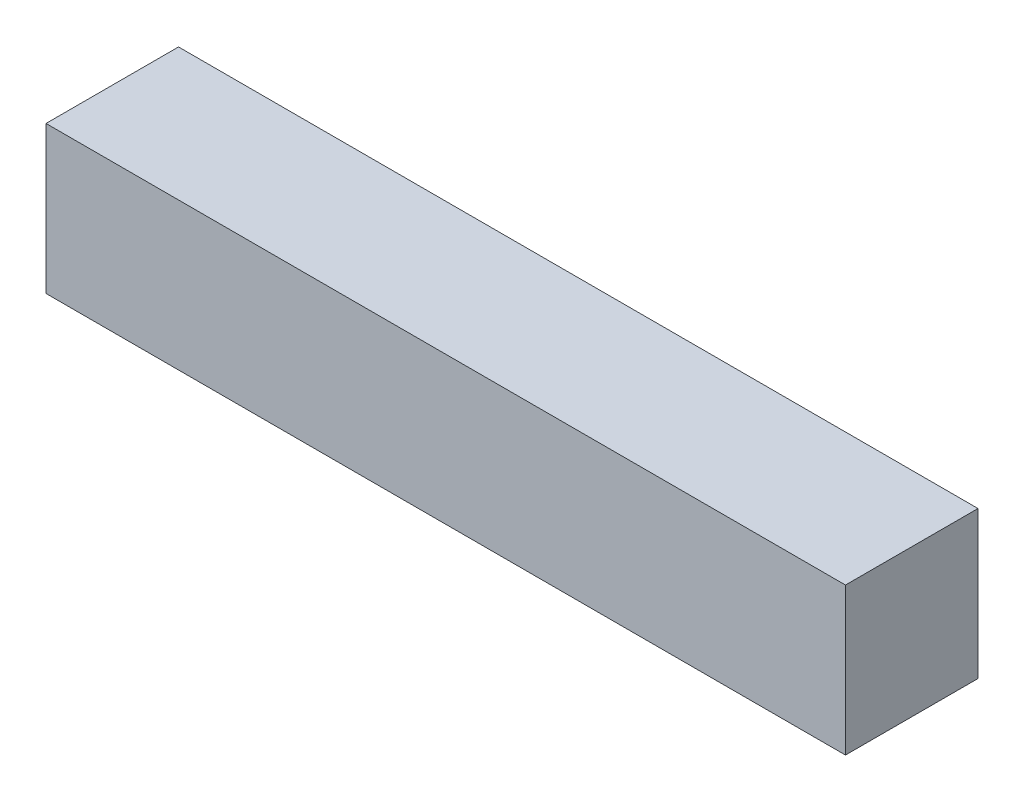
from build123d import *

# Parameters (mm, degrees)
SKIZZE1_W                       = 482.6
SKIZZE1_H                       = 88.9
AUFSATZ_LINEAR_AUSTRAGEN1_DEPTH = 80


with BuildPart() as part:
    # Skizze1 → Aufsatz-Linear austragen1 (new body)
    with BuildSketch(Plane.XY):
        Rectangle(SKIZZE1_W, SKIZZE1_H)
    extrude(amount=-AUFSATZ_LINEAR_AUSTRAGEN1_DEPTH)


solid = part.part
